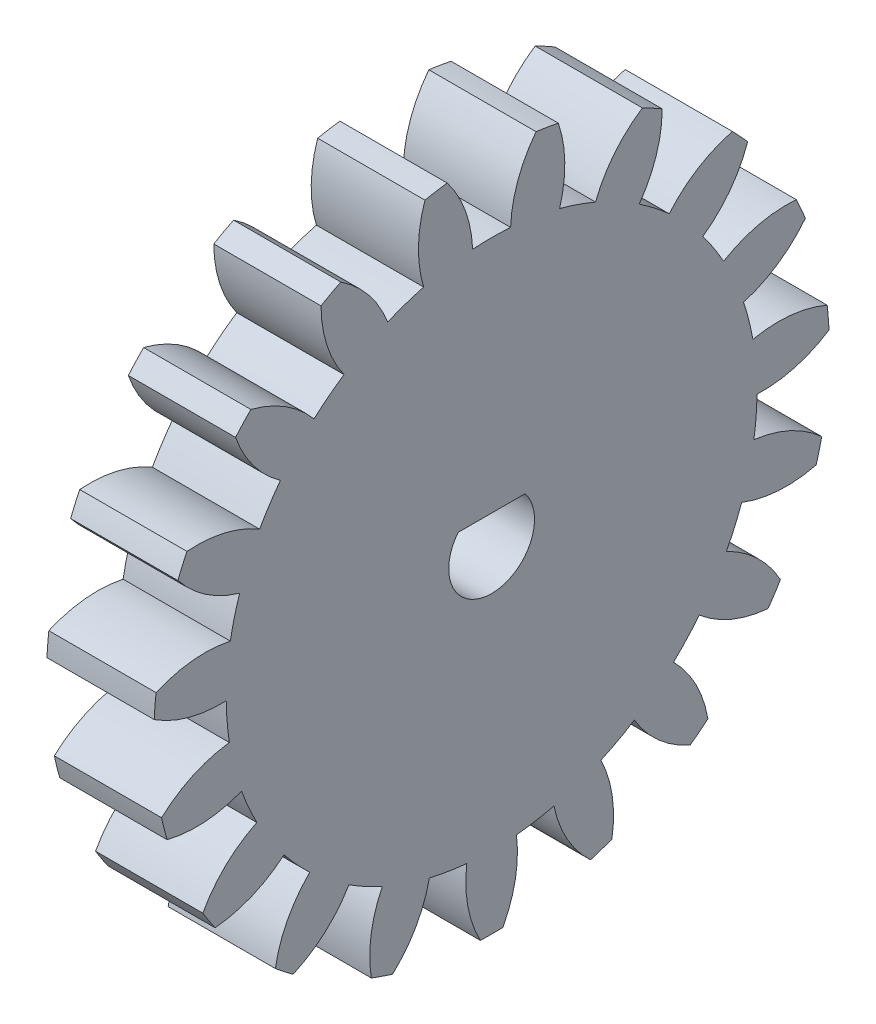
from build123d import *

# Parameters (mm, degrees)
BASPROSKE_W        = 5
BASPROSKE_H        = 15.75
TOOTHCUT_DEPTH     = 23.828162432
TEETHCUTS_COUNT    = 19
TEETHCUTS_ANGLE    = 341.052631579
BORSKE_R           = 0.4
BORE_DEPTH         = 50.0000508
CUT_EXTRUDE1_DEPTH = 23.81496003


with BuildPart() as part:
    # BasProSke → Base-Revolve (revolve)
    with BuildSketch(Plane(origin=(0, 0, 0), x_dir=(1, 0, 0), z_dir=(0, 1, 0)), mode=Mode.PRIVATE) as base_revolve_sk:
        with Locations((2.5, 7.875)):
            Rectangle(BASPROSKE_W, BASPROSKE_H)
    revolve(base_revolve_sk.sketch.rotate(Axis((-10, 0, 0), (1, 0, 0)), 180), axis=Axis((-10, 0, 0), (1, 0, 0)))

    # TooCutSke → ToothCut (cut, through all)
    with BuildSketch(Plane(origin=(0, 0, 0), x_dir=(0, 0, -1), z_dir=(1, 0, 0))):
        with BuildLine():
            ThreePointArc((0.885187307, 12.34229798), (0, 12.374), (-0.885187307, 12.34229798))
            ThreePointArc((-0.885187307, 12.34229798), (-1.228281365, 14.084307739), (-2.090723145, 15.636243855))
            ThreePointArc((-2.090723145, 15.636243855), (0, 15.7754), (2.090723145, 15.636243855))
            ThreePointArc((2.090723145, 15.636243855), (1.228281365, 14.084307739), (0.885187307, 12.34229798))
        make_face()
    toothcut = extrude(amount=TOOTHCUT_DEPTH, mode=Mode.SUBTRACT)

    # TeethCuts: ToothCut ×19 about axis
    teethcuts_axis = Axis((-10, 0, 0), (1, 0, 0))
    for i in range(1, TEETHCUTS_COUNT):
        add(toothcut.rotate(teethcuts_axis, i * TEETHCUTS_ANGLE / (TEETHCUTS_COUNT - 1)), mode=Mode.SUBTRACT)

    # BorSke → Bore (cut, symmetric)
    with BuildSketch(Plane(origin=(0, 0, 0), x_dir=(0, 0, -1), z_dir=(1, 0, 0))):
        with Locations(Location((0, 0, 0), (0, 0, 180))):
            Circle(BORSKE_R)
    extrude(amount=BORE_DEPTH, both=True, mode=Mode.SUBTRACT)

    # Sketch1 → Cut-Extrude1 (cut, through all)
    with BuildSketch(Plane(origin=(5, 0, 0), x_dir=(0, 0, -1), z_dir=(1, 0, 0))):
        with BuildLine():
            Line((1.560589416, 1.250823998), (-1.560589416, 1.250823998))
            ThreePointArc((-1.560589416, 1.250823998), (-0.66288052, -1.886952415), (2, 0))
            ThreePointArc((2, 0), (1.886952415, 0.66288052), (1.560589416, 1.250823998))
        make_face()
    extrude(amount=-CUT_EXTRUDE1_DEPTH, mode=Mode.SUBTRACT)


solid = part.part
